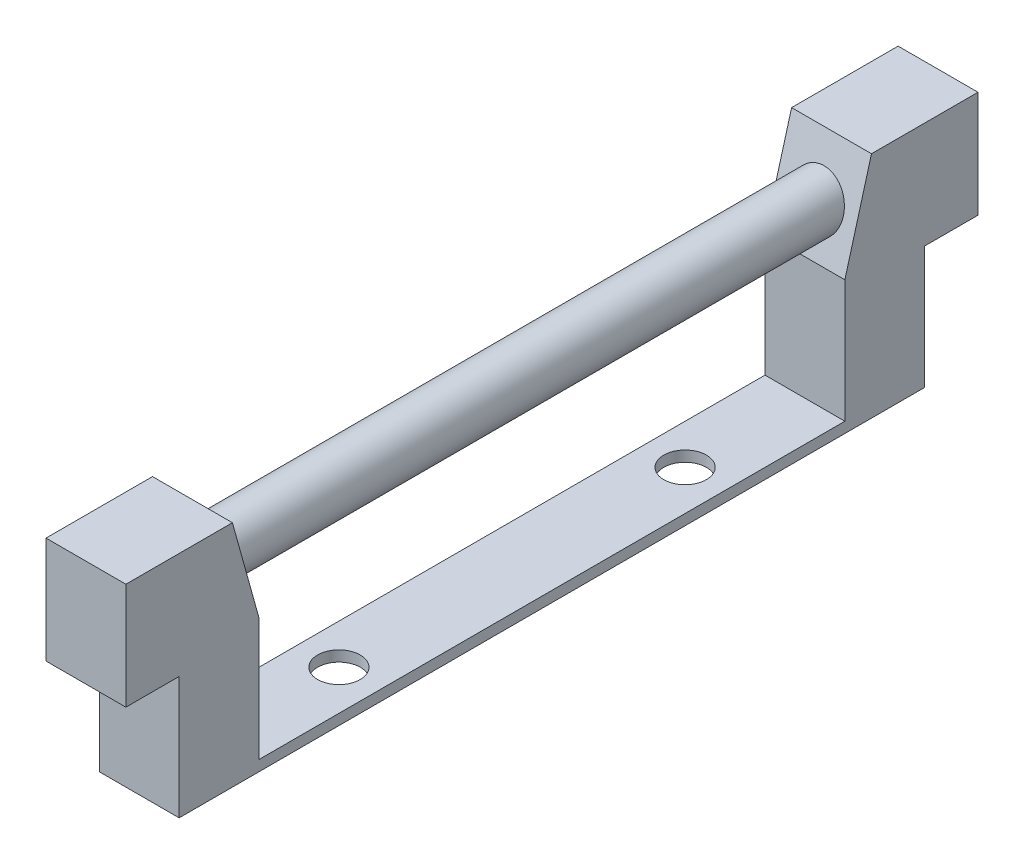
from build123d import *

# Parameters (mm, degrees)
BOSS_EXTRUDE1_DEPTH      = 7.5
BOSS_EXTRUDE1_DEPTH_BACK = 7.5
BOSS_EXTRUDE2_DEPTH      = 60
BOSS_EXTRUDE2_DEPTH_BACK = 60
SKETCH2_R                = 5
SKETCH3_R                = 4
CUT_EXTRUDE1_DEPTH       = 60


with BuildPart() as part:
    # Sketch1 → Boss-Extrude1 (new, two sides: drawn at the far end of the back side and taken through both)
    with BuildSketch(Plane(origin=(0, 0, 0), x_dir=(0, 0, -1), z_dir=(1, 0, 0)).offset(-BOSS_EXTRUDE1_DEPTH_BACK)):
        Polygon((-55, -41), (-55, -18), (-60, 0), (-80, 0), (-80, -20), (-70, -20), (-70, -43), (70, -43), (70, -20), (80, -20), (80, 0), (60, 0), (55, -18), (55, -41), align=None)
    extrude(amount=BOSS_EXTRUDE1_DEPTH + BOSS_EXTRUDE1_DEPTH_BACK)

    # Sketch2 → Boss-Extrude2 (add, two sides: drawn at the far end of the back side and taken through both)
    with BuildSketch(Plane.XY.offset(-BOSS_EXTRUDE2_DEPTH_BACK)):
        with Locations((0, -10)):
            Circle(SKETCH2_R)
    extrude(amount=BOSS_EXTRUDE2_DEPTH + BOSS_EXTRUDE2_DEPTH_BACK)

    # Sketch3 → Cut-Extrude1 (cut)
    with BuildSketch(Plane(origin=(0, -41, 0), x_dir=(1, 0, 0), z_dir=(0, 1, 0))):
        with Locations((0, 32.5)):
            Circle(SKETCH3_R)
        with Locations((0, -32.5)):
            Circle(SKETCH3_R)
    extrude(amount=-CUT_EXTRUDE1_DEPTH, mode=Mode.SUBTRACT)


solid = part.part
